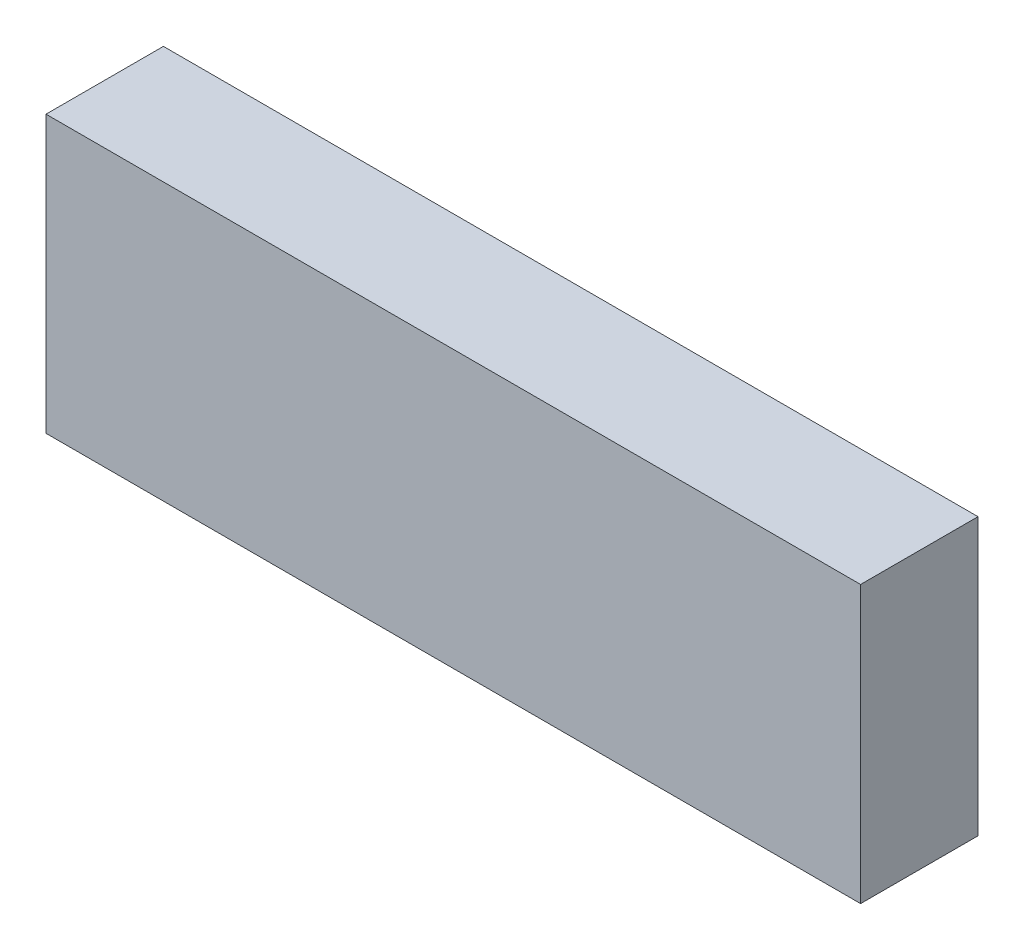
from build123d import *

# Parameters (mm, degrees)
SKETCH_1_W      = 16.65
SKETCH_1_H      = 5.65
EXTRUDE_1_DEPTH = 2.4


with BuildPart() as part:
    # 草图1 → 凸台-拉伸1 (new body)
    with BuildSketch(Plane.XY):
        Rectangle(SKETCH_1_W, SKETCH_1_H)
    extrude(amount=EXTRUDE_1_DEPTH)


solid = part.part
